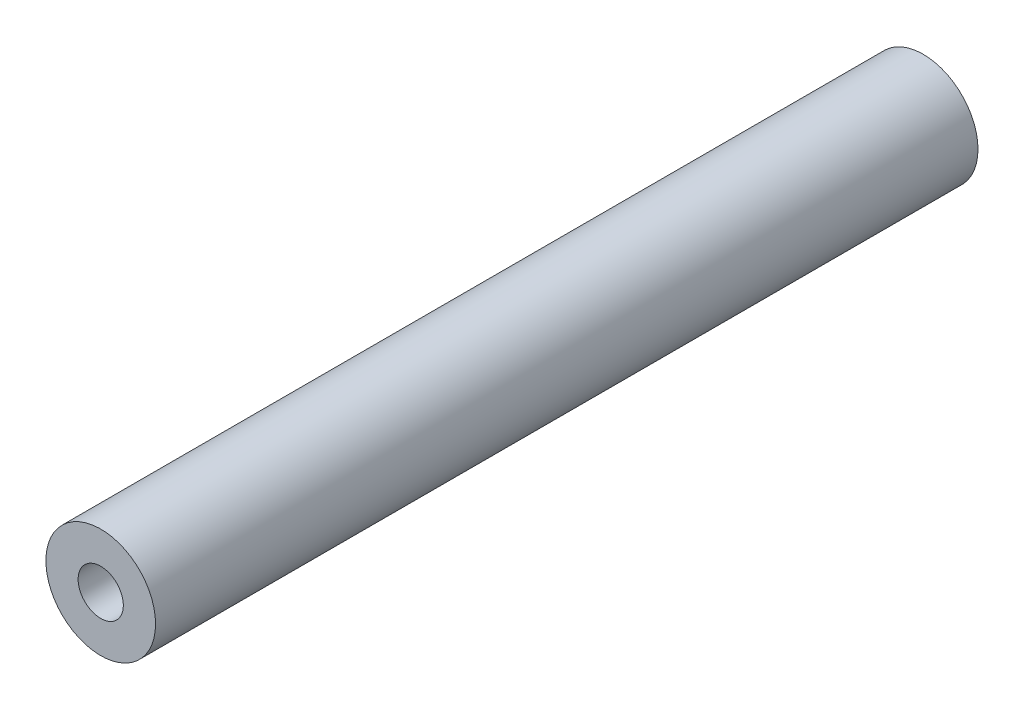
from build123d import *

# Parameters (mm, degrees)
SKETCH1_R                 = 4
BOSS_EXTRUDE1_DEPTH       = 60
M4X0_7_TAPPED_HOLE1_D     = 3.3
M4X0_7_TAPPED_HOLE1_DEPTH = 9.1
M4X0_7_TAPPED_HOLE1_TIP   = 0.991420021
M4X0_7_TAPPED_HOLE2_D     = 3.3
M4X0_7_TAPPED_HOLE2_DEPTH = 9.1
M4X0_7_TAPPED_HOLE2_TIP   = 0.991420021


with BuildPart() as part:
    # Sketch1 → Boss-Extrude1 (new body)
    with BuildSketch(Plane.XY):
        Circle(SKETCH1_R)
    extrude(amount=BOSS_EXTRUDE1_DEPTH)

    # M4x0.7 Tapped Hole1
    with Locations(Plane.XY.offset(60)):
        with Locations((0, 0)):
            Hole(M4X0_7_TAPPED_HOLE1_D / 2, depth=M4X0_7_TAPPED_HOLE1_DEPTH)
            with Locations((0, 0, -(M4X0_7_TAPPED_HOLE1_DEPTH + M4X0_7_TAPPED_HOLE1_TIP / 2))):  # 118° drill point
                Cone(0, M4X0_7_TAPPED_HOLE1_D / 2, M4X0_7_TAPPED_HOLE1_TIP, mode=Mode.SUBTRACT)

    # M4x0.7 Tapped Hole2
    with Locations(Plane(origin=(0, 0, 0), x_dir=(-1, 0, 0), z_dir=(0, 0, -1))):
        with Locations((0, 0)):
            Hole(M4X0_7_TAPPED_HOLE2_D / 2, depth=M4X0_7_TAPPED_HOLE2_DEPTH)
            with Locations((0, 0, -(M4X0_7_TAPPED_HOLE2_DEPTH + M4X0_7_TAPPED_HOLE2_TIP / 2))):  # 118° drill point
                Cone(0, M4X0_7_TAPPED_HOLE2_D / 2, M4X0_7_TAPPED_HOLE2_TIP, mode=Mode.SUBTRACT)


solid = part.part
